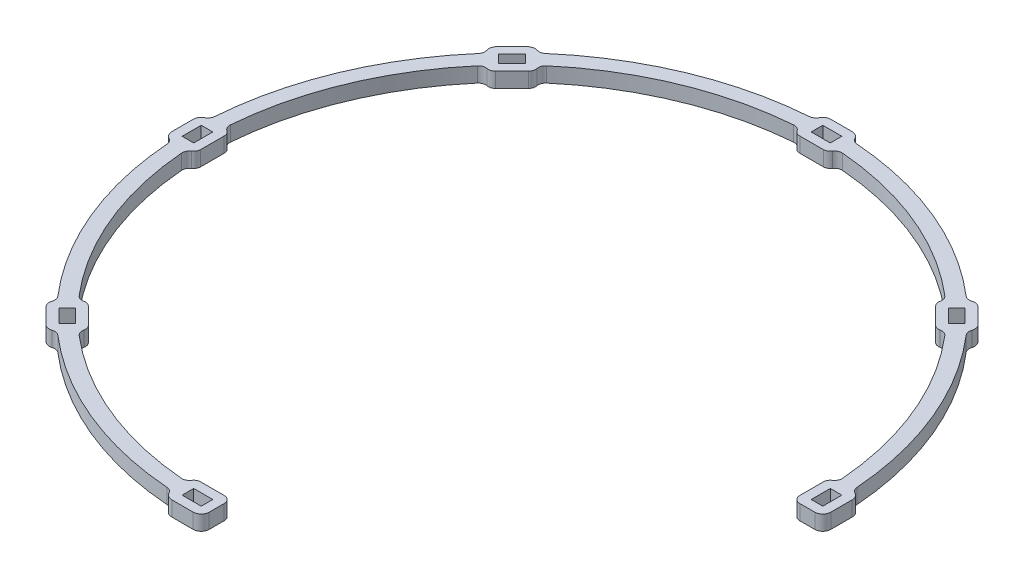
from build123d import *

# Parameters (mm, degrees)
BOSS_EXTRUDE1_DEPTH = 4
BOSS_EXTRUDE2_DEPTH = 4
CUT_EXTRUDE1_REACH  = 126.515
SKETCH3_W           = 5.1
SKETCH3_H           = 3.1
SKETCH3_W_2         = 3.1
SKETCH3_H_2         = 5.1
FILLET1_R           = 2


with BuildPart() as part:
    # Sketch1 → Boss-Extrude1 (new body)
    with BuildSketch(Plane(origin=(0, 0, 0), x_dir=(1, 0, 0), z_dir=(0, 1, 0))):
        with BuildLine():
            Line((2.38372093, -81.965345571), (2.5, -85.963655111))
            ThreePointArc((2.5, -85.963655111), (-60.811183182, 60.811183182), (85.963655111, -2.5))
            Line((85.963655111, -2.5), (81.965345571, -2.38372093))
            ThreePointArc((81.965345571, -2.38372093), (-57.982756057, 57.982756057), (2.38372093, -81.965345571))
        make_face()
    extrude(amount=BOSS_EXTRUDE1_DEPTH)

    # Sketch5 → Boss-Extrude2 (add)
    with BuildSketch(Plane(origin=(0, 4, 0), x_dir=(1, 0, 0), z_dir=(0, 1, 0))):
        with BuildLine():
            Line((-61.410398917, -54.339331105), (-64.24385294, -57.172785129))
            ThreePointArc((-64.24385294, -57.172785129), (-64.872247103, -58.689862838), (-64.24385294, -60.206940548))
            Line((-64.24385294, -60.206940548), (-60.206940548, -64.24385294))
            ThreePointArc((-60.206940548, -64.24385294), (-58.689862838, -64.872247103), (-57.172785129, -64.24385294))
            Line((-57.172785129, -64.24385294), (-54.339331105, -61.410398917))
            ThreePointArc((-54.339331105, -61.410398917), (-53.798234602, -60.104076401), (-54.339331105, -58.797753885))
            Line((-54.339331105, -58.797753885), (-58.797753885, -54.339331105))
            ThreePointArc((-58.797753885, -54.339331105), (-60.104076401, -53.798234602), (-61.410398917, -54.339331105))
        make_face()
        with BuildLine():
            Line((-3.152580981, -80), (3.152580981, -80))
            ThreePointArc((3.152580981, -80), (4.458903497, -80.541096503), (5, -81.847419019))
            Line((5, -81.847419019), (5, -85.854528128))
            ThreePointArc((5, -85.854528128), (4.371605837, -87.371605837), (2.854528128, -88))
            Line((2.854528128, -88), (-2.854528128, -88))
            ThreePointArc((-2.854528128, -88), (-4.371605837, -87.371605837), (-5, -85.854528128))
            Line((-5, -85.854528128), (-5, -81.847419019))
            ThreePointArc((-5, -81.847419019), (-4.458903497, -80.541096503), (-3.152580981, -80))
        make_face()
        with BuildLine():
            Line((-81.847419019, 5), (-85.854528128, 5))
            ThreePointArc((-85.854528128, 5), (-87.371605837, 4.371605837), (-88, 2.854528128))
            Line((-88, 2.854528128), (-88, -2.854528128))
            ThreePointArc((-88, -2.854528128), (-87.371605837, -4.371605837), (-85.854528128, -5))
            Line((-85.854528128, -5), (-81.847419019, -5))
            ThreePointArc((-81.847419019, -5), (-80.541096503, -4.458903497), (-80, -3.152580981))
            Line((-80, -3.152580981), (-80, 3.152580981))
            ThreePointArc((-80, 3.152580981), (-80.541096503, 4.458903497), (-81.847419019, 5))
        make_face()
        with BuildLine():
            Line((-54.339331105, 61.410398917), (-57.172785129, 64.24385294))
            ThreePointArc((-57.172785129, 64.24385294), (-58.689862838, 64.872247103), (-60.206940548, 64.24385294))
            Line((-60.206940548, 64.24385294), (-64.24385294, 60.206940548))
            ThreePointArc((-64.24385294, 60.206940548), (-64.872247103, 58.689862838), (-64.24385294, 57.172785129))
            Line((-64.24385294, 57.172785129), (-61.410398917, 54.339331105))
            ThreePointArc((-61.410398917, 54.339331105), (-60.104076401, 53.798234602), (-58.797753885, 54.339331105))
            Line((-58.797753885, 54.339331105), (-54.339331105, 58.797753885))
            ThreePointArc((-54.339331105, 58.797753885), (-53.798234602, 60.104076401), (-54.339331105, 61.410398917))
        make_face()
        with BuildLine():
            Line((5, 81.847419019), (5, 85.854528128))
            ThreePointArc((5, 85.854528128), (4.371605837, 87.371605837), (2.854528128, 88))
            Line((2.854528128, 88), (-2.854528128, 88))
            ThreePointArc((-2.854528128, 88), (-4.371605837, 87.371605837), (-5, 85.854528128))
            Line((-5, 85.854528128), (-5, 81.847419019))
            ThreePointArc((-5, 81.847419019), (-4.458903497, 80.541096503), (-3.152580981, 80))
            Line((-3.152580981, 80), (3.152580981, 80))
            ThreePointArc((3.152580981, 80), (4.458903497, 80.541096503), (5, 81.847419019))
        make_face()
        with BuildLine():
            Line((61.410398917, 54.339331105), (64.24385294, 57.172785129))
            ThreePointArc((64.24385294, 57.172785129), (64.872247103, 58.689862838), (64.24385294, 60.206940548))
            Line((64.24385294, 60.206940548), (60.206940548, 64.24385294))
            ThreePointArc((60.206940548, 64.24385294), (58.689862838, 64.872247103), (57.172785129, 64.24385294))
            Line((57.172785129, 64.24385294), (54.339331105, 61.410398917))
            ThreePointArc((54.339331105, 61.410398917), (53.798234602, 60.104076401), (54.339331105, 58.797753885))
            Line((54.339331105, 58.797753885), (58.797753885, 54.339331105))
            ThreePointArc((58.797753885, 54.339331105), (60.104076401, 53.798234602), (61.410398917, 54.339331105))
        make_face()
        with BuildLine():
            Line((81.847419019, -5), (85.854528128, -5))
            ThreePointArc((85.854528128, -5), (87.371605837, -4.371605837), (88, -2.854528128))
            Line((88, -2.854528128), (88, 2.854528128))
            ThreePointArc((88, 2.854528128), (87.371605837, 4.371605837), (85.854528128, 5))
            Line((85.854528128, 5), (81.847419019, 5))
            ThreePointArc((81.847419019, 5), (80.541096503, 4.458903497), (80, 3.152580981))
            Line((80, 3.152580981), (80, -3.152580981))
            ThreePointArc((80, -3.152580981), (80.541096503, -4.458903497), (81.847419019, -5))
        make_face()
    extrude(amount=-BOSS_EXTRUDE2_DEPTH)

    # Sketch3 → Cut-Extrude1 (cut, up to next)
    with BuildSketch(Plane(origin=(0, 4, 0), x_dir=(1, 0, 0), z_dir=(0, 1, 0)), mode=Mode.PRIVATE) as cut_extrude1_sk1:
        Polygon((-62.296107423, -58.689862838), (-58.689862838, -62.296107423), (-56.497831817, -60.104076401), (-60.104076401, -56.497831817), align=None)
    cut_extrude1_tool1 = extrude(cut_extrude1_sk1.sketch, amount=-CUT_EXTRUDE1_REACH, mode=Mode.PRIVATE) & part.part
    # Sketch3 → Cut-Extrude1 (cut, up to next)
    with BuildSketch(Plane(origin=(0, 4, 0), x_dir=(1, 0, 0), z_dir=(0, 1, 0)), mode=Mode.PRIVATE) as cut_extrude1_sk2:
        with Locations((0, -84)):
            Rectangle(SKETCH3_W, SKETCH3_H)
    cut_extrude1_tool2 = extrude(cut_extrude1_sk2.sketch, amount=-CUT_EXTRUDE1_REACH, mode=Mode.PRIVATE) & part.part
    # Sketch3 → Cut-Extrude1 (cut, up to next)
    with BuildSketch(Plane(origin=(0, 4, 0), x_dir=(1, 0, 0), z_dir=(0, 1, 0)), mode=Mode.PRIVATE) as cut_extrude1_sk3:
        with Locations((-84, 0)):
            Rectangle(SKETCH3_W_2, SKETCH3_H_2)
    cut_extrude1_tool3 = extrude(cut_extrude1_sk3.sketch, amount=-CUT_EXTRUDE1_REACH, mode=Mode.PRIVATE) & part.part
    # Sketch3 → Cut-Extrude1 (cut, up to next)
    with BuildSketch(Plane(origin=(0, 4, 0), x_dir=(1, 0, 0), z_dir=(0, 1, 0)), mode=Mode.PRIVATE) as cut_extrude1_sk4:
        Polygon((-58.689862838, 62.296107423), (-62.296107423, 58.689862838), (-60.104076401, 56.497831817), (-56.497831817, 60.104076401), align=None)
    cut_extrude1_tool4 = extrude(cut_extrude1_sk4.sketch, amount=-CUT_EXTRUDE1_REACH, mode=Mode.PRIVATE) & part.part
    # Sketch3 → Cut-Extrude1 (cut, up to next)
    with BuildSketch(Plane(origin=(0, 4, 0), x_dir=(1, 0, 0), z_dir=(0, 1, 0)), mode=Mode.PRIVATE) as cut_extrude1_sk5:
        with Locations((0, 84)):
            Rectangle(SKETCH3_W, SKETCH3_H)
    cut_extrude1_tool5 = extrude(cut_extrude1_sk5.sketch, amount=-CUT_EXTRUDE1_REACH, mode=Mode.PRIVATE) & part.part
    # Sketch3 → Cut-Extrude1 (cut, up to next)
    with BuildSketch(Plane(origin=(0, 4, 0), x_dir=(1, 0, 0), z_dir=(0, 1, 0)), mode=Mode.PRIVATE) as cut_extrude1_sk6:
        Polygon((62.296107423, 58.689862838), (58.689862838, 62.296107423), (56.497831817, 60.104076401), (60.104076401, 56.497831817), align=None)
    cut_extrude1_tool6 = extrude(cut_extrude1_sk6.sketch, amount=-CUT_EXTRUDE1_REACH, mode=Mode.PRIVATE) & part.part
    # Sketch3 → Cut-Extrude1 (cut, up to next)
    with BuildSketch(Plane(origin=(0, 4, 0), x_dir=(1, 0, 0), z_dir=(0, 1, 0)), mode=Mode.PRIVATE) as cut_extrude1_sk7:
        with Locations((84, 0)):
            Rectangle(SKETCH3_W_2, SKETCH3_H_2)
    cut_extrude1_tool7 = extrude(cut_extrude1_sk7.sketch, amount=-CUT_EXTRUDE1_REACH, mode=Mode.PRIVATE) & part.part
    add(cut_extrude1_tool1.solids().sort_by_distance((-59.39697, 4, 59.39697))[0], mode=Mode.SUBTRACT)
    add(cut_extrude1_tool2.solids().sort_by_distance((0, 4, 84))[0], mode=Mode.SUBTRACT)
    add(cut_extrude1_tool3.solids().sort_by_distance((-84, 4, 0))[0], mode=Mode.SUBTRACT)
    add(cut_extrude1_tool4.solids().sort_by_distance((-59.39697, 4, -59.39697))[0], mode=Mode.SUBTRACT)
    add(cut_extrude1_tool5.solids().sort_by_distance((0, 4, -84))[0], mode=Mode.SUBTRACT)
    add(cut_extrude1_tool6.solids().sort_by_distance((59.39697, 4, -59.39697))[0], mode=Mode.SUBTRACT)
    add(cut_extrude1_tool7.solids().sort_by_distance((84, 4, 0))[0], mode=Mode.SUBTRACT)

    # Fillet1
    fillet1_edges = [part.edges().sort_by_distance(p)[0] for p in [
        (5, 2, -85.854528128),
        (5, 2, -81.847419019),
        (-5, 2, -81.847419019),
        (-5, 2, -85.854528128),
        (64.24385294, 2, -57.172785129),
        (61.410398917, 2, -54.339331105),
        (54.339331105, 2, -61.410398917),
        (57.172785129, 2, -64.24385294),
        (81.847419019, 2, -5),
        (85.854528128, 2, -5),
        (-5, 2, 85.854528128),
        (-5, 2, 81.847419019),
        (-64.24385294, 2, 57.172785129),
        (-61.410398917, 2, 54.339331105),
        (-54.339331105, 2, 61.410398917),
        (-57.172785129, 2, 64.24385294),
        (-85.854528128, 2, -5),
        (-81.847419019, 2, -5),
        (-81.847419019, 2, 5),
        (-85.854528128, 2, 5),
        (-57.172785129, 2, -64.24385294),
        (-54.339331105, 2, -61.410398917),
        (-61.410398917, 2, -54.339331105),
        (-64.24385294, 2, -57.172785129),
    ]]
    fillet(fillet1_edges, radius=FILLET1_R)


solid = part.part
